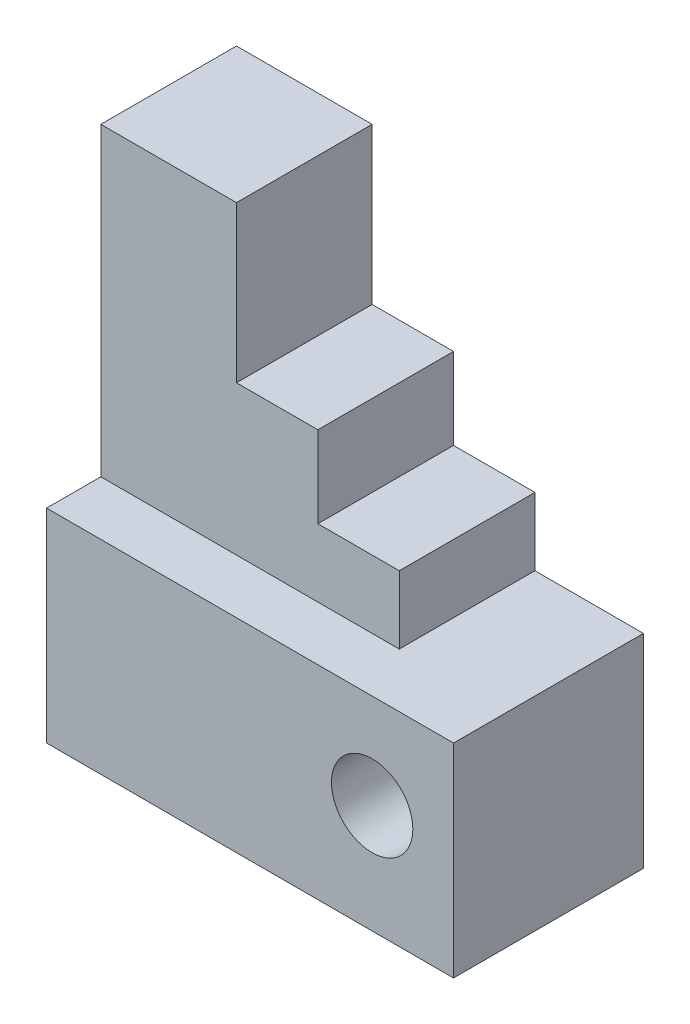
from build123d import *

# Parameters (mm, degrees)
SKETCH1_W           = 60
SKETCH1_H           = 30
SKETCH1_R           = 6
BOSS_EXTRUDE3_DEPTH = 28
BOSS_EXTRUDE4_DEPTH = 20


with BuildPart() as part:
    # Sketch1 → Boss-Extrude3 (new body)
    with BuildSketch(Plane.XY):
        with Locations((30, 15)):
            Rectangle(SKETCH1_W, SKETCH1_H)
        with Locations((48, 16)):
            Circle(SKETCH1_R, mode=Mode.SUBTRACT)
    extrude(amount=BOSS_EXTRUDE3_DEPTH)

    # Sketch4 → Boss-Extrude4 (add)
    with BuildSketch(Plane.XY):
        Polygon((44, 30), (44, 40), (32, 40), (32, 52), (20, 52), (20, 75), (0, 75), (0, 30), align=None)
    extrude(amount=BOSS_EXTRUDE4_DEPTH)


solid = part.part
